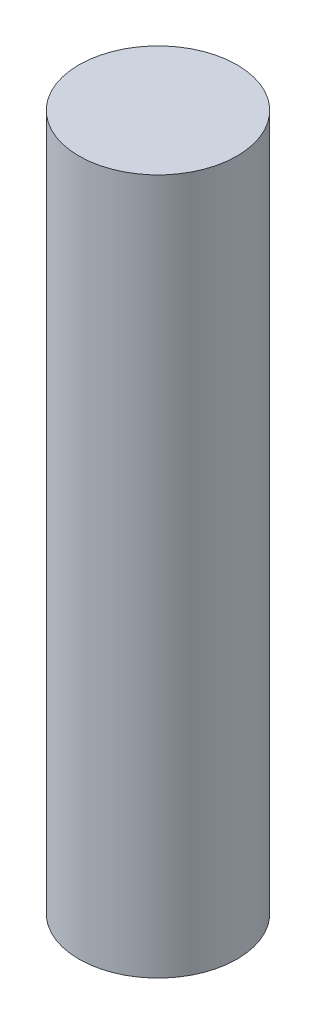
from build123d import *

# Parameters (mm, degrees)
SKETCH1_R                  = 3.96875
BOSS_EXTRUDE1_DEPTH        = 34.925
F_10_32_TAPPED_HOLE1_D     = 4.0386
F_10_32_TAPPED_HOLE1_DEPTH = 7.62
F_10_32_TAPPED_HOLE1_TIP   = 1.213317848


with BuildPart() as part:
    # Sketch1 → Boss-Extrude1 (new body)
    with BuildSketch(Plane(origin=(0, 0, 0), x_dir=(1, 0, 0), z_dir=(0, 1, 0))):
        with Locations(Location((0, 0, 0), (0, 0, 270))):
            Circle(SKETCH1_R)
    extrude(amount=BOSS_EXTRUDE1_DEPTH)

    # #10-32 Tapped Hole1
    with Locations(Plane(origin=(0, 0, 0), x_dir=(-1, 0, 0), z_dir=(0, -1, 0))):
        with Locations((0, 0)):
            Hole(F_10_32_TAPPED_HOLE1_D / 2, depth=F_10_32_TAPPED_HOLE1_DEPTH)
            with Locations((0, 0, -(F_10_32_TAPPED_HOLE1_DEPTH + F_10_32_TAPPED_HOLE1_TIP / 2))):  # 118° drill point
                Cone(0, F_10_32_TAPPED_HOLE1_D / 2, F_10_32_TAPPED_HOLE1_TIP, mode=Mode.SUBTRACT)


solid = part.part
